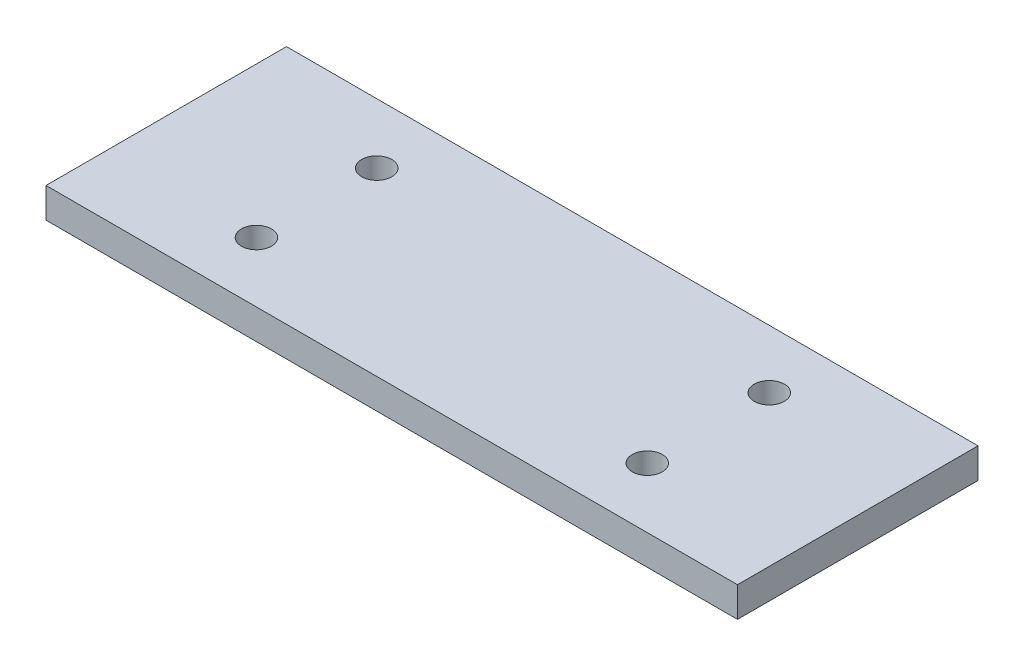
from build123d import *

# Parameters (mm, degrees)
SKETCH1_W             = 115
SKETCH1_H             = 40
BOSS_EXTRUDE1_DEPTH   = 2.5
F_5_0MM_DOWEL_HOLE1_D = 5


with BuildPart() as part:
    # Sketch1 → Boss-Extrude1 (new, symmetric)
    with BuildSketch(Plane(origin=(0, 0, 0), x_dir=(1, 0, 0), z_dir=(0, 1, 0))):
        Rectangle(SKETCH1_W, SKETCH1_H)
    extrude(amount=BOSS_EXTRUDE1_DEPTH, both=True)

    # Ø5.0mm Dowel Hole1 (through all)
    with Locations(Plane(origin=(0, 2.5, 0), x_dir=(1, 0, 0), z_dir=(0, 1, 0))):
        with Locations((-32.5, 10), (-32.5, -10), (32.5, -10), (32.5, 10.290518385)):
            Hole(F_5_0MM_DOWEL_HOLE1_D / 2)


solid = part.part
